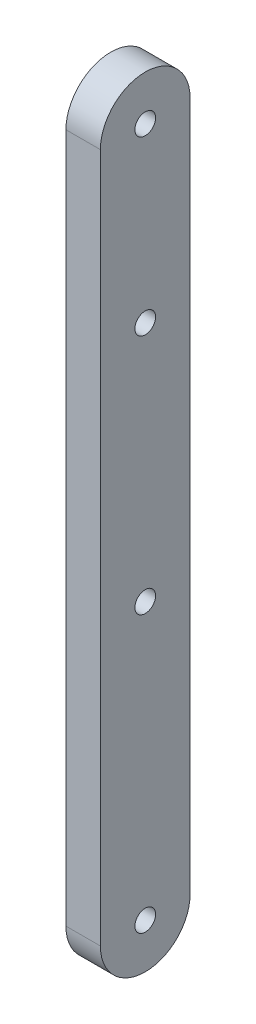
from build123d import *

# Parameters (mm, degrees)
SKETCH1_R           = 1.5
BOSS_EXTRUDE1_DEPTH = 5


with BuildPart() as part:
    # Sketch1 → Boss-Extrude1 (new body)
    with BuildSketch(Plane(origin=(0, 0, 0), x_dir=(0, 0, -1), z_dir=(1, 0, 0))):
        with BuildLine():
            Line((-6.5, 50), (-6.5, -50))
            ThreePointArc((-6.5, -50), (0, -56.5), (6.5, -50))
            Line((6.5, -50), (6.5, 50))
            ThreePointArc((6.5, 50), (0, 56.5), (-6.5, 50))
        make_face()
        with Locations((0, 50)):
            Circle(SKETCH1_R, mode=Mode.SUBTRACT)
        with Locations((0, 25)):
            Circle(SKETCH1_R, mode=Mode.SUBTRACT)
        with Locations((0, -50)):
            Circle(SKETCH1_R, mode=Mode.SUBTRACT)
        with Locations((0, -10)):
            Circle(SKETCH1_R, mode=Mode.SUBTRACT)
    extrude(amount=BOSS_EXTRUDE1_DEPTH)


solid = part.part
